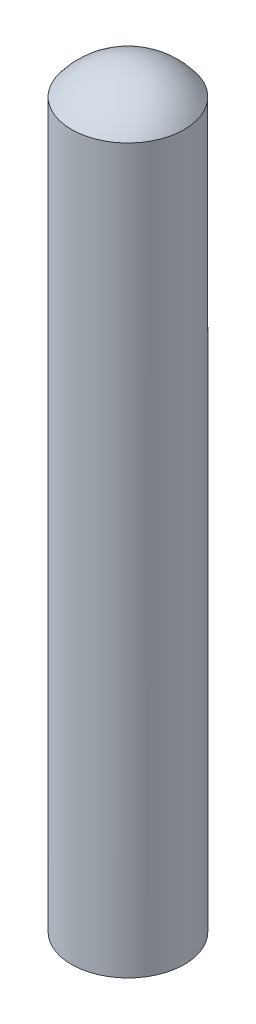
from build123d import *


with BuildPart() as part:
    # Sketch1 → Revolve1 (revolve)
    with BuildSketch(Plane.XY, mode=Mode.PRIVATE) as revolve1_sk:
        with BuildLine():
            Line((3, 38.4), (3, 0))
            Line((3, 0), (0, 0))
            Line((0, 0), (0, 39.9))
            ThreePointArc((0, 39.9), (1.677050983, 39.504101966), (3, 38.4))
        make_face()
    revolve(revolve1_sk.sketch.rotate(Axis((0, 39.9, 0), (0, -1, 0)), 180), axis=Axis((0, 39.9, 0), (0, -1, 0)))


solid = part.part
